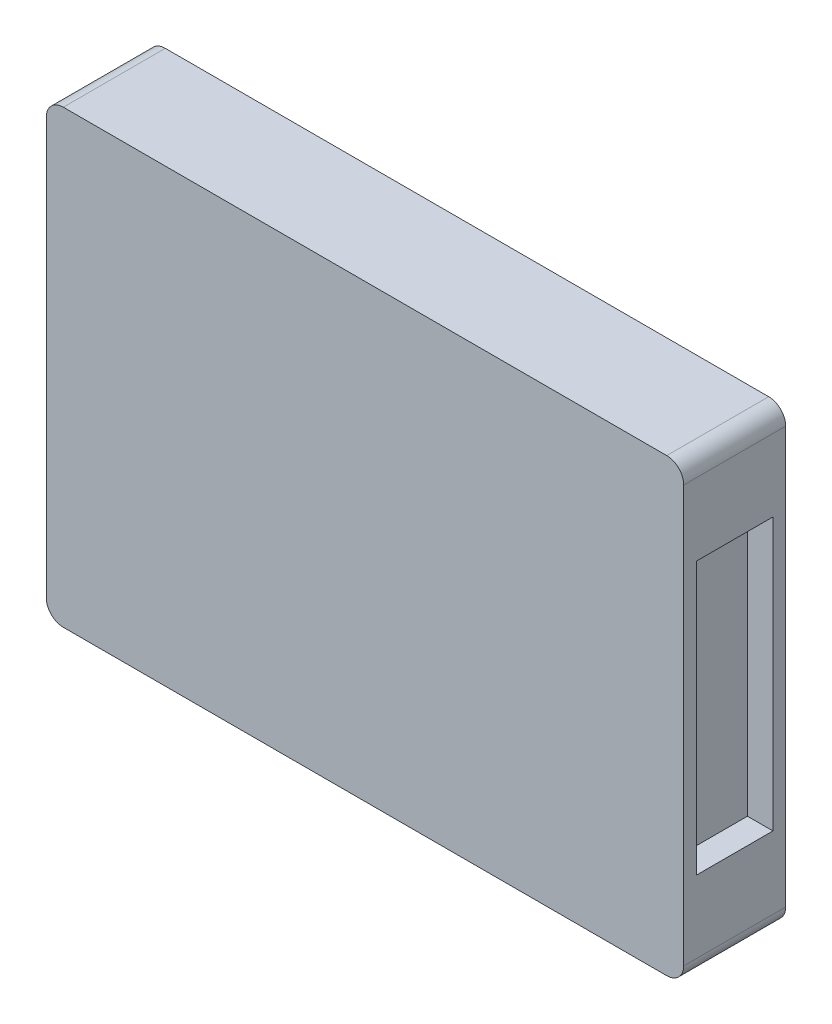
from build123d import *

# Parameters (mm, degrees)
SKETCH_1_W          = 75
SKETCH_1_H          = 53
EXTRUDE_1_DEPTH     = 12
FILLET_1_R          = 2
SKETCH_2_W          = 9
SKETCH_2_H          = 32
CUT_EXTRUDE_1_DEPTH = 3
CUT_EXTRUDE_2_DEPTH = 3


with BuildPart() as part:
    # 草图1 → 凸台-拉伸1 (new body)
    with BuildSketch(Plane.XY):
        Rectangle(SKETCH_1_W, SKETCH_1_H)
    extrude(amount=EXTRUDE_1_DEPTH)

    # 圆角1
    fillet_1_edges = [part.edges().sort_by_distance(p)[0] for p in [
        (-37.5, 26.5, 6),
        (37.5, 26.5, 6),
        (37.5, -26.5, 6),
        (-37.5, -26.5, 6),
    ]]
    fillet(fillet_1_edges, radius=FILLET_1_R)

    # 草图2 → 切除-拉伸1 (cut)
    with BuildSketch(Plane(origin=(37.5, 0, 0), x_dir=(0, 0, -1), z_dir=(1, 0, 0))):
        with Locations((-6, 0)):
            Rectangle(SKETCH_2_W, SKETCH_2_H)
    extrude(amount=-CUT_EXTRUDE_1_DEPTH, mode=Mode.SUBTRACT)

    # 草图3 → 切除-拉伸2 (cut)
    with BuildSketch(Plane.ZY.offset(37.5)):
        with BuildLine():
            Line((3.5, -4), (3.5, 4))
            ThreePointArc((3.5, 4), (6, 6.5), (8.5, 4))
            Line((8.5, 4), (8.5, -4))
            ThreePointArc((8.5, -4), (6, -6.5), (3.5, -4))
        make_face()
    extrude(amount=-CUT_EXTRUDE_2_DEPTH, mode=Mode.SUBTRACT)


solid = part.part
